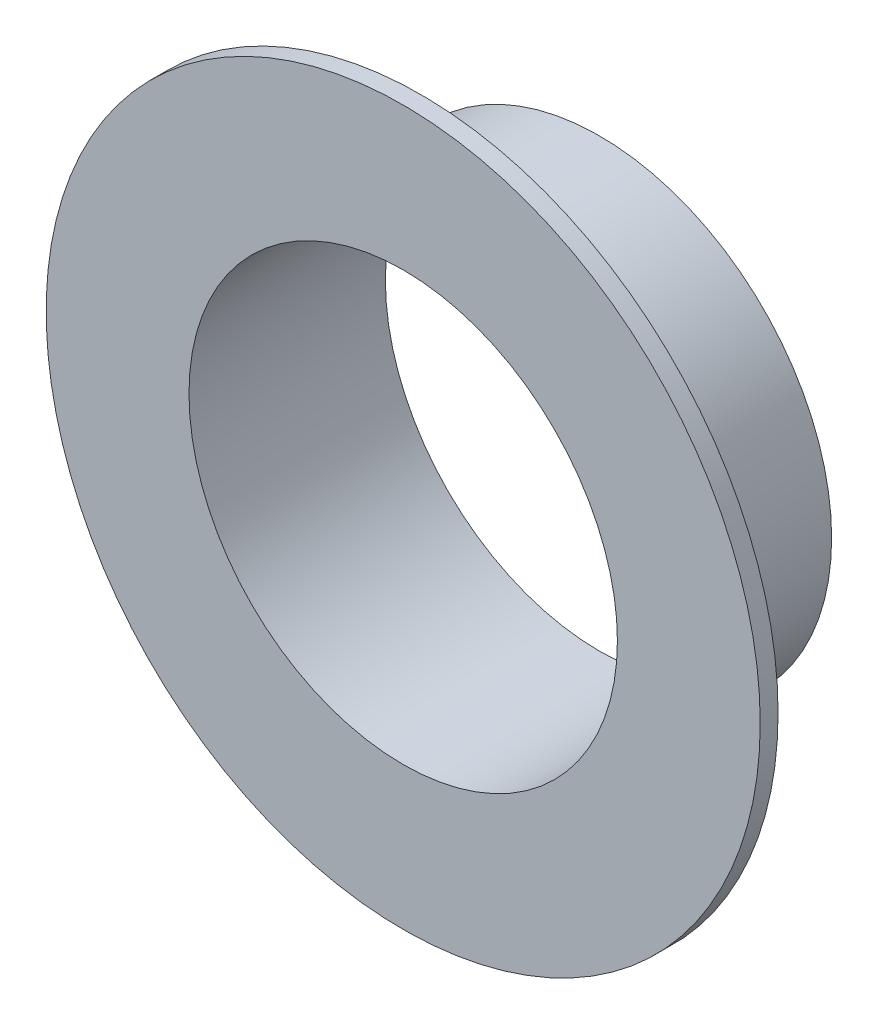
from build123d import *

# Parameters (mm, degrees)
ESQUISSE1_R          = 6.5
ESQUISSE1_R_2        = 6
BASE_EXTRUSION_DEPTH = 5
ESQUISSE2_R          = 10
ESQUISSE2_R_2        = 6
BOSS_EXTRU_1_DEPTH   = 0.5


with BuildPart() as part:
    # Esquisse1 → Base-Extrusion (new body)
    with BuildSketch(Plane.XY):
        Circle(ESQUISSE1_R)
        Circle(ESQUISSE1_R_2, mode=Mode.SUBTRACT)
    extrude(amount=BASE_EXTRUSION_DEPTH)

    # Esquisse2 → Boss.-Extru.1 (add)
    with BuildSketch(Plane.XY.offset(5)):
        Circle(ESQUISSE2_R)
        Circle(ESQUISSE2_R_2, mode=Mode.SUBTRACT)
    extrude(amount=BOSS_EXTRU_1_DEPTH)


solid = part.part
